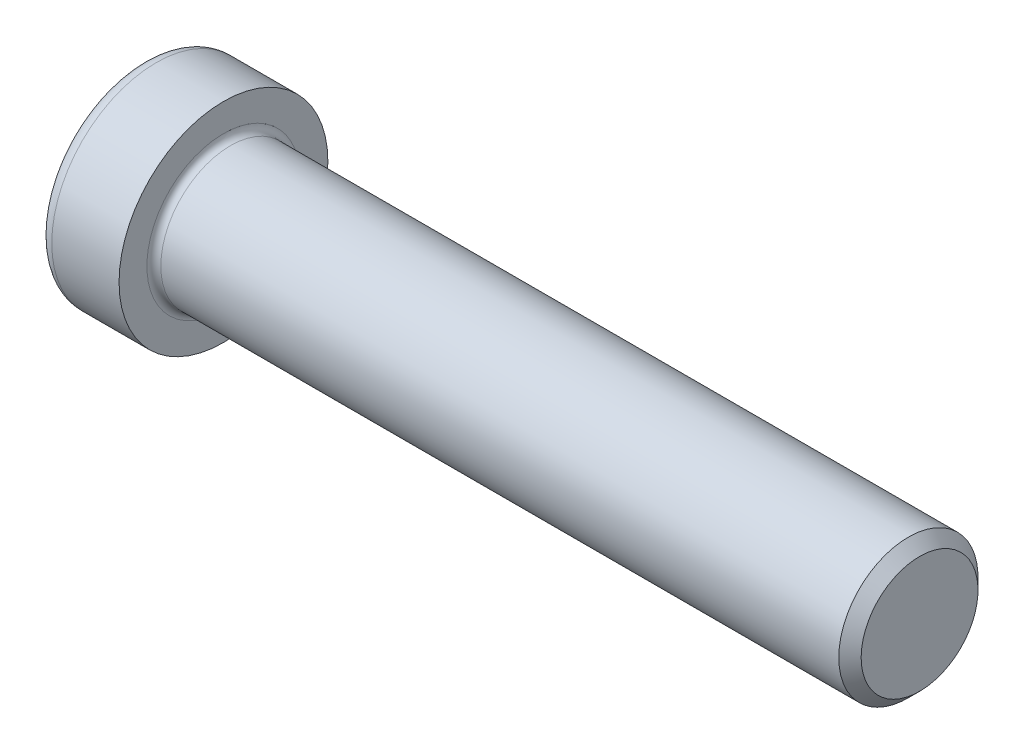
from build123d import *

# Parameters (mm, degrees)
FILLET1_R   = 0.6
FILLET2_R   = 1.2
HEX_2_DEPTH = 5


with BuildPart() as part:
    # BodySke → Base-Revolve (revolve)
    with BuildSketch(Plane.XY, mode=Mode.PRIVATE) as base_revolve_sk:
        Polygon((0, 0), (0, 9), (7, 9), (7, 6), (66.036, 6), (67, 5.036), (67, 0), align=None)
    revolve(base_revolve_sk.sketch.rotate(Axis((-31.75, 0, 0), (1, 0, 0)), 90), axis=Axis((-31.75, 0, 0), (1, 0, 0)))

    # Fillet1
    fillet1_edges = [part.edges().sort_by_distance(p)[0] for p in [
        (7, 0, -6),
    ]]
    fillet(fillet1_edges, radius=FILLET1_R)

    # Fillet2
    fillet2_edges = [part.edges().sort_by_distance(p)[0] for p in [
        (0, 0, -9),
    ]]
    fillet(fillet2_edges, radius=FILLET2_R)

    # Sketch2 → Hex-PreBroach (revolve, cut)
    with BuildSketch(Plane.XY, mode=Mode.PRIVATE) as hex_prebroach_sk:
        Polygon((0, 4), (5, 4), (7.309401077, 0), (0, 0), align=None)
    revolve(hex_prebroach_sk.sketch.rotate(Axis((0, 0, 0), (1, 0, 0)), 90), axis=Axis((0, 0, 0), (1, 0, 0)), mode=Mode.SUBTRACT)

    # Sketch3 → Hex 2 (cut)
    with BuildSketch(Plane(origin=(0, 0, 0), x_dir=(0, 0.500000000000001, 0.866025403784438), z_dir=(-1, 0, 0))):
        Polygon((2.309401077, 4), (-2.309401077, 4), (-4.618802154, 0), (-2.309401077, -4), (2.309401077, -4), (4.618802154, 0), align=None)
    extrude(amount=-HEX_2_DEPTH, mode=Mode.SUBTRACT)


solid = part.part
